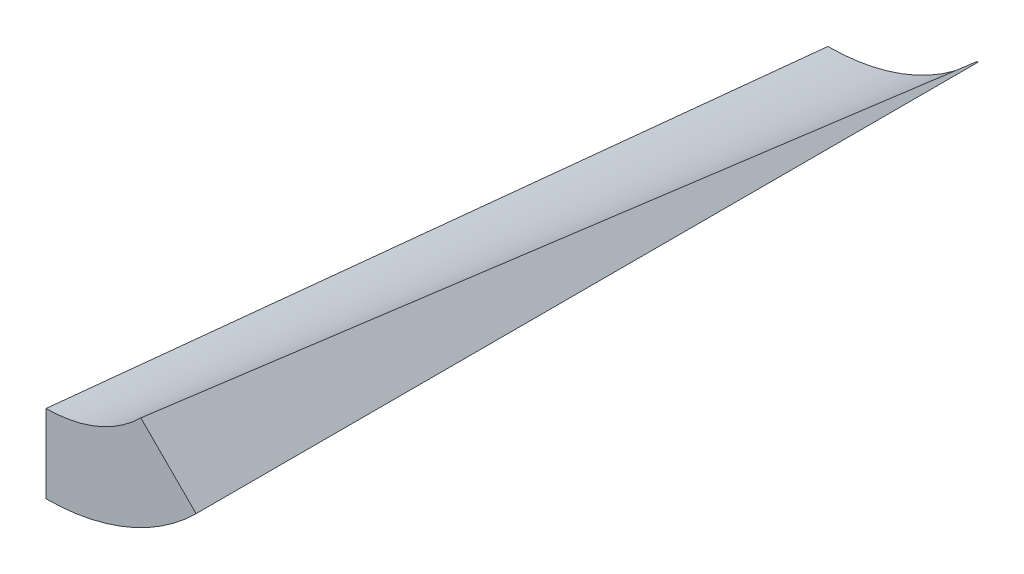
from build123d import *


with BuildPart() as part:
    # Sketch1 for Loft3 → Loft3 section 0
    with BuildSketch(Plane.XY):
        with BuildLine():
            Line((0, 0.1), (0, 0))
            # circular arc as an exact rational Bezier (weights 1, cos(half-angle), 1)
            Bezier((0, 0), (11.245898218, 0), (19.197949109, 7.952050891), weights=[1, 0.923879533, 1])
            Line((19.197949109, 7.952050891), (19.127238431, 8.022761569))
            Bezier((19.127238431, 8.022761569), (11.204476862, 0.1), (0, 0.1), weights=[1, 0.923879533, 1])
        make_face()
    # Sketch2 for Loft3 → Loft3 section 1
    with BuildSketch(Plane.XY.offset(100)):
        with BuildLine():
            Line((0, 10), (0, 0))
            Bezier((0, 0), (11.245898218, 0), (19.197949109, 7.952050891), weights=[1, 0.923879533, 1])
            Line((19.197949109, 7.952050891), (12.126881297, 15.023118703))
            Bezier((12.126881297, 15.023118703), (7.103762595, 10), (0, 10), weights=[1, 0.923879533, 1])
        make_face()
    loft()


solid = part.part
